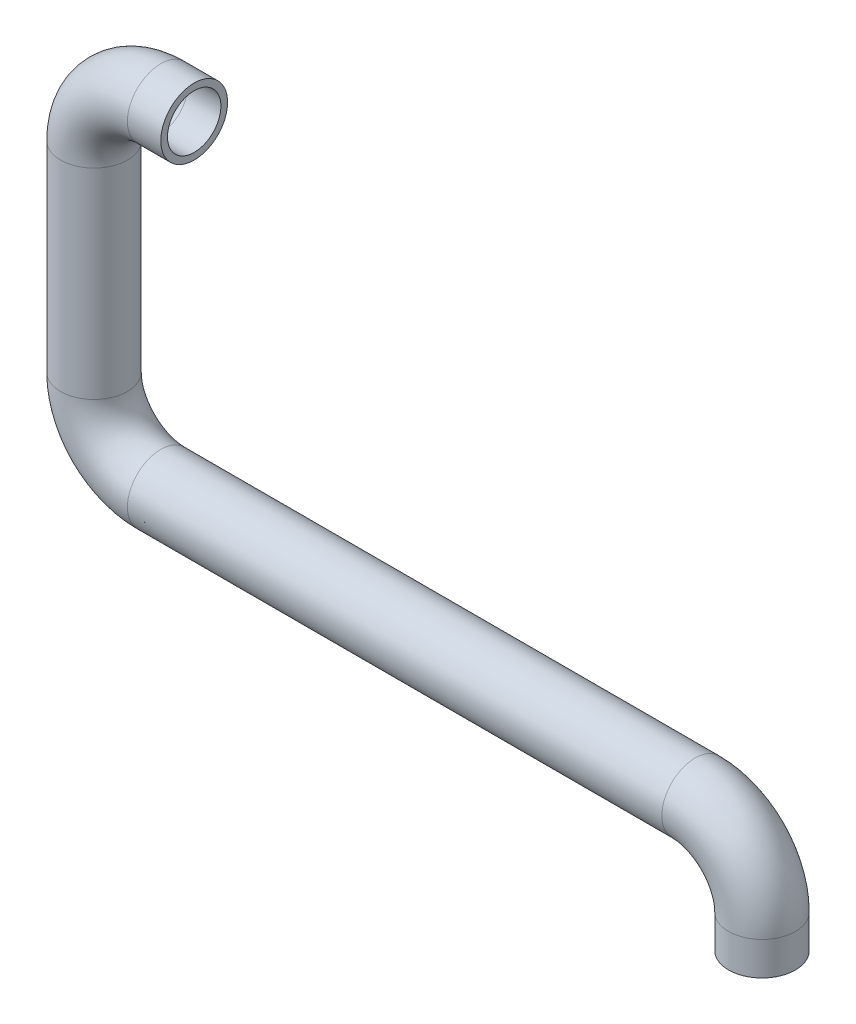
from build123d import *

# Parameters (mm, degrees)
SWEEP_1_PROFILE_R   = 5
SWEEP_1_PROFILE_R_2 = 4


with BuildPart() as part:
    # 扫描-薄件1: sweep along a path in 草图1
    with BuildLine(Plane.XY) as sweep_1_path:
        Line((-85, 50), (-90, 50))
        ThreePointArc((-90, 50), (-97.071067812, 47.071067812), (-100, 40))
        Line((-100, 40), (-100, 10))
        ThreePointArc((-100, 10), (-97.071067812, 2.928932188), (-90, 0))
        Line((-90, 0), (-10, 0))
        ThreePointArc((-10, 0), (-2.928932188, -2.928932188), (0, -10))
        Line((0, -10), (0, -15))
    # 扫描-薄件1 profile (on start of the path) → 扫描-薄件1 (sweep)
    with BuildSketch(Plane(origin=(-85, 50, 0), x_dir=(0, -1, 0), z_dir=(-1, 0, 0))):
        Circle(SWEEP_1_PROFILE_R)
        Circle(SWEEP_1_PROFILE_R_2, mode=Mode.SUBTRACT)
    sweep(path=sweep_1_path.line)


solid = part.part
